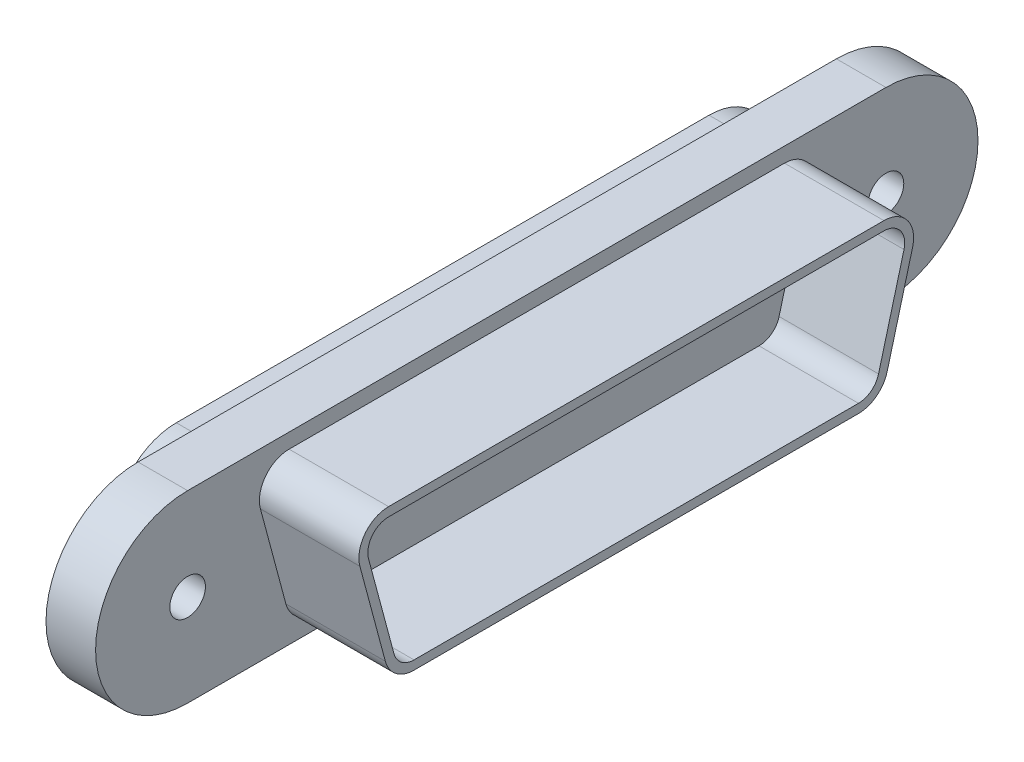
from build123d import *

# Parameters (mm, degrees)
BOSS_EXTRUDE1_DEPTH      = 4.2418
BOSS_EXTRUDE2_DEPTH      = 8.509
CUT_EXTRUDE1_DEPTH       = 8.509
X_0_397_DIAMETER_HOLE1_D = 3.048
BOSS_EXTRUDE3_DEPTH      = 3.81


with BuildPart() as part:
    # Sketch1 → Boss-Extrude1 (new body)
    with BuildSketch(Plane(origin=(0, 0, 0), x_dir=(0, 0, -1), z_dir=(1, 0, 0))):
        with BuildLine():
            Line((-29.8704, 7.874), (29.8704, 7.874))
            ThreePointArc((29.8704, 7.874), (37.7444, 0), (29.8704, -7.874))
            Line((29.8704, -7.874), (-29.8704, -7.874))
            ThreePointArc((-29.8704, -7.874), (-37.7444, 0), (-29.8704, 7.874))
        make_face()
    extrude(amount=BOSS_EXTRUDE1_DEPTH)

    # Sketch2 → Boss-Extrude2 (add)
    with BuildSketch(Plane(origin=(4.2418, 0, 0), x_dir=(0, 0, -1), z_dir=(1, 0, 0))):
        with BuildLine():
            Line((-21.188107553, 6.604), (21.188107553, 6.604))
            ThreePointArc((21.188107553, 6.604), (23.203225037, 5.61025403), (23.641559152, 3.406599625))
            Line((23.641559152, 3.406599625), (21.463668116, -4.721400375))
            ThreePointArc((21.463668116, -4.721400375), (20.556470547, -6.079117484), (19.010216517, -6.604))
            Line((19.010216517, -6.604), (-19.010216517, -6.604))
            ThreePointArc((-19.010216517, -6.604), (-20.556470547, -6.079117484), (-21.463668116, -4.721400375))
            Line((-21.463668116, -4.721400375), (-23.641559152, 3.406599625))
            ThreePointArc((-23.641559152, 3.406599625), (-23.203225037, 5.61025403), (-21.188107553, 6.604))
        make_face()
    extrude(amount=BOSS_EXTRUDE2_DEPTH)

    # Sketch3 → Cut-Extrude1 (cut)
    with BuildSketch(Plane(origin=(12.7508, 0, 0), x_dir=(0, 0, -1), z_dir=(1, 0, 0))):
        with BuildLine():
            Line((-22.905523672, 3.603819738), (-20.727632636, -4.524180262))
            ThreePointArc((-20.727632636, -4.524180262), (-20.092594338, -5.474582239), (-19.010216517, -5.842))
            Line((-19.010216517, -5.842), (19.010216517, -5.842))
            ThreePointArc((19.010216517, -5.842), (20.092594338, -5.474582239), (20.727632636, -4.524180262))
            Line((20.727632636, -4.524180262), (22.905523672, 3.603819738))
            ThreePointArc((22.905523672, 3.603819738), (22.598689792, 5.146377821), (21.188107553, 5.842))
            Line((21.188107553, 5.842), (-21.188107553, 5.842))
            ThreePointArc((-21.188107553, 5.842), (-22.598689792, 5.146377821), (-22.905523672, 3.603819738))
        make_face()
    extrude(amount=-CUT_EXTRUDE1_DEPTH, mode=Mode.SUBTRACT)

    # X (0.397) Diameter Hole1 (through all)
    with Locations(Plane(origin=(4.2418, 0, 0), x_dir=(0, 0, -1), z_dir=(1, 0, 0))):
        with Locations((-29.8704, 0), (29.8704, 0)):
            Hole(X_0_397_DIAMETER_HOLE1_D / 2)

    # Sketch7 → Boss-Extrude3 (add)
    with BuildSketch(Plane.ZY):
        with BuildLine():
            Line((-22.786295813, 5.334), (22.786295813, 5.334))
            ThreePointArc((22.786295813, 5.334), (28.120295813, 0), (22.786295813, -5.334))
            Line((22.786295813, -5.334), (-22.786295813, -5.334))
            ThreePointArc((-22.786295813, -5.334), (-28.120295813, 0), (-22.786295813, 5.334))
        make_face()
    extrude(amount=BOSS_EXTRUDE3_DEPTH)


solid = part.part
